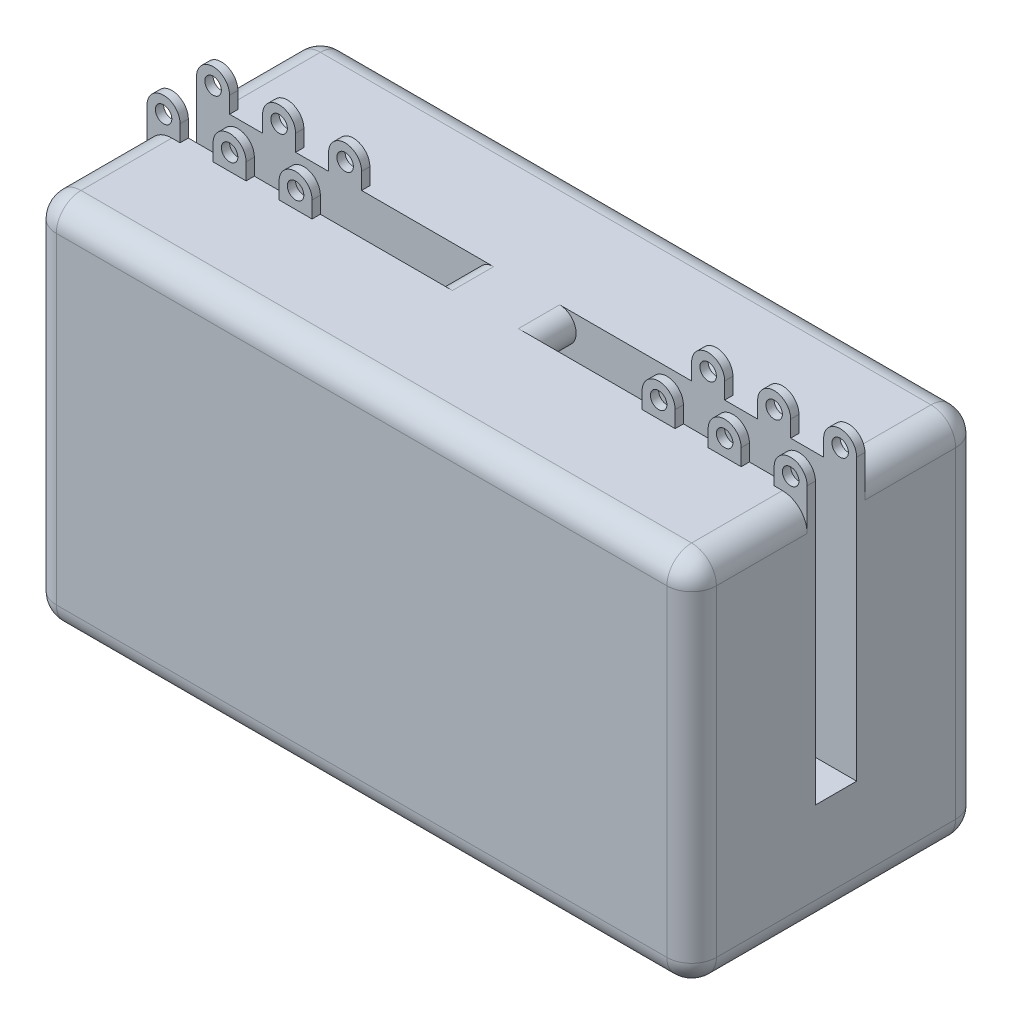
from build123d import *

# Parameters (mm, degrees)
SKETCH_1_W      = 800
SKETCH_1_H      = 450
EXTRUDE_1_DEPTH = 150
SKETCH_2_R      = 10
EXTRUDE_2_DEPTH = 10
SKETCH_3_W      = 800
SKETCH_3_H      = 130
EXTRUDE_3_DEPTH = 50
SKETCH_4_W      = 800
SKETCH_4_H      = 450
EXTRUDE_4_DEPTH = 150
EXTRUDE_START   = -10
SKETCH_5_R      = 10
EXTRUDE_5_DEPTH = 10
FILLET_1_R      = 30


with BuildPart() as part:
    # 草图1 → 凸台-拉伸1 (new body)
    with BuildSketch(Plane.XY):
        Rectangle(SKETCH_1_W, SKETCH_1_H)
    extrude(amount=EXTRUDE_1_DEPTH)

    # 草图2 → 凸台-拉伸2 (add)
    # profile 1 of 6: a face of its own
    with BuildSketch(Plane(origin=(0, 0, 0), x_dir=(-1, 0, 0), z_dir=(0, 0, -1))):
        with BuildLine():
            Line((400, 245), (400, 225))
            Line((400, 225), (360, 225))
            Line((360, 225), (360, 245))
            ThreePointArc((360, 245), (380, 265), (400, 245))
        make_face()
        with Locations((380, 245)):
            Circle(SKETCH_2_R, mode=Mode.SUBTRACT)
    # profile 2 of 6: a face of its own
    with BuildSketch(Plane(origin=(0, 0, 0), x_dir=(-1, 0, 0), z_dir=(0, 0, -1))):
        with BuildLine():
            Line((240, 245), (240, 225))
            Line((240, 225), (200, 225))
            Line((200, 225), (200, 245))
            ThreePointArc((200, 245), (220, 265), (240, 245))
        make_face()
        with Locations((220, 245)):
            Circle(SKETCH_2_R, mode=Mode.SUBTRACT)
    # profile 3 of 6: a face of its own
    with BuildSketch(Plane(origin=(0, 0, 0), x_dir=(-1, 0, 0), z_dir=(0, 0, -1))):
        with BuildLine():
            Line((-200, 245), (-200, 225))
            Line((-200, 225), (-240, 225))
            Line((-240, 225), (-240, 245))
            ThreePointArc((-240, 245), (-220, 265), (-200, 245))
        make_face()
        with Locations((-220, 245)):
            Circle(SKETCH_2_R, mode=Mode.SUBTRACT)
    # profile 4 of 6: a face of its own
    with BuildSketch(Plane(origin=(0, 0, 0), x_dir=(-1, 0, 0), z_dir=(0, 0, -1))):
        with BuildLine():
            Line((-360, 245), (-360, 225))
            Line((-360, 225), (-400, 225))
            Line((-400, 225), (-400, 245))
            ThreePointArc((-400, 245), (-380, 265), (-360, 245))
        make_face()
        with Locations((-380, 245)):
            Circle(SKETCH_2_R, mode=Mode.SUBTRACT)
    # profile 5 of 6: a face of its own
    with BuildSketch(Plane(origin=(0, 0, 0), x_dir=(-1, 0, 0), z_dir=(0, 0, -1))):
        with BuildLine():
            Line((-280, 245), (-280, 225))
            Line((-280, 225), (-320, 225))
            Line((-320, 225), (-320, 245))
            ThreePointArc((-320, 245), (-300, 265), (-280, 245))
        make_face()
        with Locations((-300, 245)):
            Circle(SKETCH_2_R, mode=Mode.SUBTRACT)
    # profile 6 of 6: a face of its own
    with BuildSketch(Plane(origin=(0, 0, 0), x_dir=(-1, 0, 0), z_dir=(0, 0, -1))):
        with BuildLine():
            Line((320, 245), (320, 225))
            Line((320, 225), (280, 225))
            Line((280, 225), (280, 245))
            ThreePointArc((280, 245), (300, 265), (320, 245))
        make_face()
        with Locations((300, 245)):
            Circle(SKETCH_2_R, mode=Mode.SUBTRACT)
    extrude(amount=-EXTRUDE_2_DEPTH)

    # 草图3 → 凸台-拉伸3 (add)
    with BuildSketch(Plane(origin=(0, 0, 0), x_dir=(-1, 0, 0), z_dir=(0, 0, -1))):
        with BuildLine():
            Line((-40, 225), (40, 225))
            ThreePointArc((40, 225), (60, 205), (40, 185))
            Line((40, 185), (-40, 185))
            ThreePointArc((-40, 185), (-60, 205), (-40, 225))
        make_face()
        with Locations((0, -160)):
            Rectangle(SKETCH_3_W, SKETCH_3_H)
    extrude(amount=EXTRUDE_3_DEPTH)

    # 草图4 → 凸台-拉伸4 (add)
    with BuildSketch(Plane(origin=(0, 0, -50), x_dir=(-1, 0, 0), z_dir=(0, 0, -1))):
        Rectangle(SKETCH_4_W, SKETCH_4_H)
    extrude(amount=EXTRUDE_4_DEPTH)

    # 草图5 → 凸台-拉伸5 (add)
    # profile 1 of 6: a face of its own
    with BuildSketch(Plane.XY.offset(-50).offset(EXTRUDE_START)):
        with BuildLine():
            Line((400, 245), (400, 225))
            Line((400, 225), (360, 225))
            Line((360, 225), (360, 245))
            ThreePointArc((360, 245), (380, 265), (400, 245))
        make_face()
        with Locations(Location((380, 245, 0), (0, 0, 180))):
            Circle(SKETCH_5_R, mode=Mode.SUBTRACT)
    # profile 2 of 6: a face of its own
    with BuildSketch(Plane.XY.offset(-50).offset(EXTRUDE_START)):
        with BuildLine():
            Line((240, 245), (240, 225))
            Line((240, 225), (200, 225))
            Line((200, 225), (200, 245))
            ThreePointArc((200, 245), (220, 265), (240, 245))
        make_face()
        with Locations(Location((220, 245, 0), (0, 0, 180))):
            Circle(SKETCH_5_R, mode=Mode.SUBTRACT)
    # profile 3 of 6: a face of its own
    with BuildSketch(Plane.XY.offset(-50).offset(EXTRUDE_START)):
        with BuildLine():
            Line((-200, 245), (-200, 225))
            Line((-200, 225), (-240, 225))
            Line((-240, 225), (-240, 245))
            ThreePointArc((-240, 245), (-220, 265), (-200, 245))
        make_face()
        with Locations(Location((-220, 245, 0), (0, 0, 180))):
            Circle(SKETCH_5_R, mode=Mode.SUBTRACT)
    # profile 4 of 6: a face of its own
    with BuildSketch(Plane.XY.offset(-50).offset(EXTRUDE_START)):
        with BuildLine():
            Line((-360, 245), (-360, 225))
            Line((-360, 225), (-400, 225))
            Line((-400, 225), (-400, 245))
            ThreePointArc((-400, 245), (-380, 265), (-360, 245))
        make_face()
        with Locations(Location((-380, 245, 0), (0, 0, 180))):
            Circle(SKETCH_5_R, mode=Mode.SUBTRACT)
    # profile 5 of 6: a face of its own
    with BuildSketch(Plane.XY.offset(-50).offset(EXTRUDE_START)):
        with BuildLine():
            Line((-280, 245), (-280, 225))
            Line((-280, 225), (-320, 225))
            Line((-320, 225), (-320, 245))
            ThreePointArc((-320, 245), (-300, 265), (-280, 245))
        make_face()
        with Locations(Location((-300, 245, 0), (0, 0, 180))):
            Circle(SKETCH_5_R, mode=Mode.SUBTRACT)
    # profile 6 of 6: a face of its own
    with BuildSketch(Plane.XY.offset(-50).offset(EXTRUDE_START)):
        with BuildLine():
            Line((320, 245), (320, 225))
            Line((320, 225), (280, 225))
            Line((280, 225), (280, 245))
            ThreePointArc((280, 245), (300, 265), (320, 245))
        make_face()
        with Locations(Location((300, 245, 0), (0, 0, 180))):
            Circle(SKETCH_5_R, mode=Mode.SUBTRACT)
    extrude(amount=EXTRUDE_5_DEPTH)

    # 圆角1
    fillet_1_edges = [part.edges().sort_by_distance(p)[0] for p in [
        (0, 225, -200),
        (-400, 225, -130),
        (400, 0, -200),
        (400, 225, -130),
        (0, -225, -200),
        (-400, 0, -200),
        (-400, 0, 150),
        (0, -225, 150),
        (400, 0, 150),
        (400, -225, -25),
        (-400, -225, -25),
        (-400, 225, 80),
        (400, 225, 80),
        (0, 225, 150),
    ]]
    fillet(fillet_1_edges, radius=FILLET_1_R)


solid = part.part
